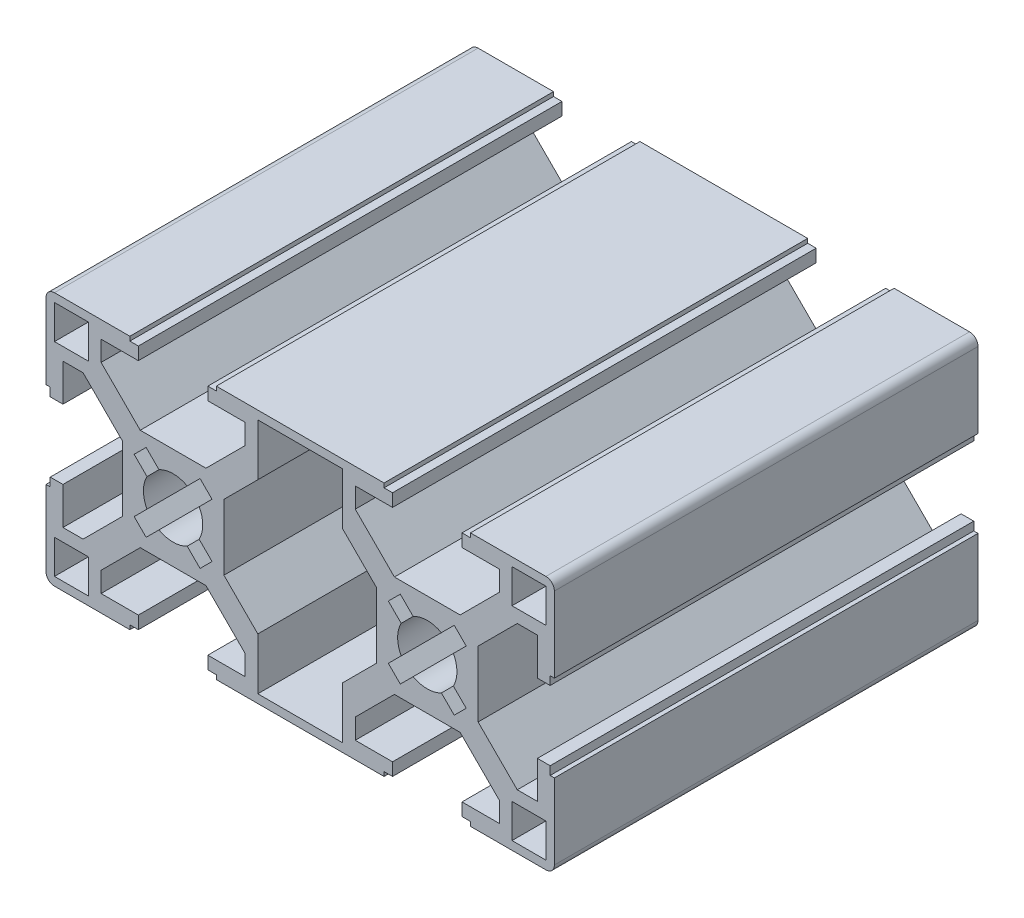
from build123d import *

# Parameters (mm, degrees)
ESBO_O1_W                      = 4
ESBO_O1_H                      = 4
RESSALTO_EXTRUS_O1_DEPTH       = 50
PADR_OCIRCULAR1_COUNT          = 4
PADR_O_LINEAR1_COUNT           = 2
PADR_O_LINEAR1_PITCH           = 30
PADR_O_LINEAR1_COPY_1_SKETCH_W = 4
PADR_O_LINEAR1_COPY_1_SKETCH_H = 4
PADR_O_LINEAR1_COPY_1_DEPTH    = 50
PADR_O_LINEAR1_COPY_2_SKETCH_W = 4
PADR_O_LINEAR1_COPY_2_SKETCH_H = 4
PADR_O_LINEAR1_COPY_2_DEPTH    = 50
PADR_O_LINEAR1_COPY_3_SKETCH_W = 4
PADR_O_LINEAR1_COPY_3_SKETCH_H = 4
PADR_O_LINEAR1_COPY_3_DEPTH    = 50
ESBO_O4_W                      = 10
ESBO_O4_H                      = 28
CORTE_EXTRUS_O1_DEPTH          = 69.92024376
FILETE1_R                      = 1


with BuildPart() as part:
    # Esboço1 → Ressalto-extrusão1 (new body)
    with BuildSketch(Plane.XY):
        with BuildLine():
            ThreePointArc((-1.664601464, 3.078815026), (-0.858529967, 3.393070335), (0, 3.5))
            Line((0, 3.5), (0, 6))
            Line((0, 6), (-3.878679656, 6))
            Line((-3.878679656, 6), (-8.5, 10.621320344))
            Line((-8.5, 10.621320344), (-8.5, 13))
            Line((-8.5, 13), (-4.1, 13))
            Line((-4.1, 13), (-4.1, 14.5))
            Line((-4.1, 14.5), (-5.1, 14.5))
            Line((-5.1, 14.5), (-5.1, 15))
            Line((-5.1, 15), (-15, 15))
            Line((-15, 15), (-15, 5.1))
            Line((-15, 5.1), (-14.5, 5.1))
            Line((-14.5, 5.1), (-14.5, 4.1))
            Line((-14.5, 4.1), (-13, 4.1))
            Line((-13, 4.1), (-13, 8.5))
            Line((-13, 8.5), (-10.621320344, 8.5))
            Line((-10.621320344, 8.5), (-6, 3.878679656))
            Line((-6, 3.878679656), (-6, 0))
            Line((-6, 0), (-3.5, 0))
            ThreePointArc((-3.5, 0), (-3.393070335, 0.858529967), (-3.078815026, 1.664601464))
            Line((-3.078815026, 1.664601464), (-4.596194078, 3.181980515))
            Line((-4.596194078, 3.181980515), (-3.181980515, 4.596194078))
            Line((-3.181980515, 4.596194078), (-1.664601464, 3.078815026))
        make_face()
        with Locations((-12, 12)):
            Rectangle(ESBO_O1_W, ESBO_O1_H, mode=Mode.SUBTRACT)
    ressalto_extrus_o1 = extrude(amount=RESSALTO_EXTRUS_O1_DEPTH)

    # PadrãoCircular1: Ressalto-extrusão1 ×4 about axis
    padr_ocircular1_axis = Axis((0, 0, 0), (0, 0, 1))
    for i in range(1, PADR_OCIRCULAR1_COUNT):
        add(ressalto_extrus_o1.rotate(padr_ocircular1_axis, i * 360 / PADR_OCIRCULAR1_COUNT))

    # Padrão linear1: Ressalto-extrusão1 ×2
    with Locations(*[(i * PADR_O_LINEAR1_PITCH, 0, 0) for i in range(1, PADR_O_LINEAR1_COUNT)]):
        add(ressalto_extrus_o1)

    # Padrão linear1 copy 1 sketch → Padrão linear1 copy 1 (add)
    with BuildSketch(Plane(origin=(30, 0, 0), x_dir=(0, 1, 0), z_dir=(0, 0, 1))):
        with BuildLine():
            ThreePointArc((-1.664601464, 3.078815026), (-0.858529967, 3.393070335), (0, 3.5))
            Line((0, 3.5), (0, 6))
            Line((0, 6), (-3.878679656, 6))
            Line((-3.878679656, 6), (-8.5, 10.621320344))
            Line((-8.5, 10.621320344), (-8.5, 13))
            Line((-8.5, 13), (-4.1, 13))
            Line((-4.1, 13), (-4.1, 14.5))
            Line((-4.1, 14.5), (-5.1, 14.5))
            Line((-5.1, 14.5), (-5.1, 15))
            Line((-5.1, 15), (-15, 15))
            Line((-15, 15), (-15, 5.1))
            Line((-15, 5.1), (-14.5, 5.1))
            Line((-14.5, 5.1), (-14.5, 4.1))
            Line((-14.5, 4.1), (-13, 4.1))
            Line((-13, 4.1), (-13, 8.5))
            Line((-13, 8.5), (-10.621320344, 8.5))
            Line((-10.621320344, 8.5), (-6, 3.878679656))
            Line((-6, 3.878679656), (-6, 0))
            Line((-6, 0), (-3.5, 0))
            ThreePointArc((-3.5, 0), (-3.393070335, 0.858529967), (-3.078815026, 1.664601464))
            Line((-3.078815026, 1.664601464), (-4.596194078, 3.181980515))
            Line((-4.596194078, 3.181980515), (-3.181980515, 4.596194078))
            Line((-3.181980515, 4.596194078), (-1.664601464, 3.078815026))
        make_face()
        with Locations((-12, 12)):
            Rectangle(PADR_O_LINEAR1_COPY_1_SKETCH_W, PADR_O_LINEAR1_COPY_1_SKETCH_H, mode=Mode.SUBTRACT)
    extrude(amount=PADR_O_LINEAR1_COPY_1_DEPTH)

    # Padrão linear1 copy 2 sketch → Padrão linear1 copy 2 (add)
    with BuildSketch(Plane(origin=(30, 0, 0), x_dir=(-1, 0, 0), z_dir=(0, 0, 1))):
        with BuildLine():
            ThreePointArc((-1.664601464, 3.078815026), (-0.858529967, 3.393070335), (0, 3.5))
            Line((0, 3.5), (0, 6))
            Line((0, 6), (-3.878679656, 6))
            Line((-3.878679656, 6), (-8.5, 10.621320344))
            Line((-8.5, 10.621320344), (-8.5, 13))
            Line((-8.5, 13), (-4.1, 13))
            Line((-4.1, 13), (-4.1, 14.5))
            Line((-4.1, 14.5), (-5.1, 14.5))
            Line((-5.1, 14.5), (-5.1, 15))
            Line((-5.1, 15), (-15, 15))
            Line((-15, 15), (-15, 5.1))
            Line((-15, 5.1), (-14.5, 5.1))
            Line((-14.5, 5.1), (-14.5, 4.1))
            Line((-14.5, 4.1), (-13, 4.1))
            Line((-13, 4.1), (-13, 8.5))
            Line((-13, 8.5), (-10.621320344, 8.5))
            Line((-10.621320344, 8.5), (-6, 3.878679656))
            Line((-6, 3.878679656), (-6, 0))
            Line((-6, 0), (-3.5, 0))
            ThreePointArc((-3.5, 0), (-3.393070335, 0.858529967), (-3.078815026, 1.664601464))
            Line((-3.078815026, 1.664601464), (-4.596194078, 3.181980515))
            Line((-4.596194078, 3.181980515), (-3.181980515, 4.596194078))
            Line((-3.181980515, 4.596194078), (-1.664601464, 3.078815026))
        make_face()
        with Locations((-12, 12)):
            Rectangle(PADR_O_LINEAR1_COPY_2_SKETCH_W, PADR_O_LINEAR1_COPY_2_SKETCH_H, mode=Mode.SUBTRACT)
    extrude(amount=PADR_O_LINEAR1_COPY_2_DEPTH)

    # Padrão linear1 copy 3 sketch → Padrão linear1 copy 3 (add)
    with BuildSketch(Plane(origin=(30, 0, 0), x_dir=(0, -1, 0), z_dir=(0, 0, 1))):
        with BuildLine():
            ThreePointArc((-1.664601464, 3.078815026), (-0.858529967, 3.393070335), (0, 3.5))
            Line((0, 3.5), (0, 6))
            Line((0, 6), (-3.878679656, 6))
            Line((-3.878679656, 6), (-8.5, 10.621320344))
            Line((-8.5, 10.621320344), (-8.5, 13))
            Line((-8.5, 13), (-4.1, 13))
            Line((-4.1, 13), (-4.1, 14.5))
            Line((-4.1, 14.5), (-5.1, 14.5))
            Line((-5.1, 14.5), (-5.1, 15))
            Line((-5.1, 15), (-15, 15))
            Line((-15, 15), (-15, 5.1))
            Line((-15, 5.1), (-14.5, 5.1))
            Line((-14.5, 5.1), (-14.5, 4.1))
            Line((-14.5, 4.1), (-13, 4.1))
            Line((-13, 4.1), (-13, 8.5))
            Line((-13, 8.5), (-10.621320344, 8.5))
            Line((-10.621320344, 8.5), (-6, 3.878679656))
            Line((-6, 3.878679656), (-6, 0))
            Line((-6, 0), (-3.5, 0))
            ThreePointArc((-3.5, 0), (-3.393070335, 0.858529967), (-3.078815026, 1.664601464))
            Line((-3.078815026, 1.664601464), (-4.596194078, 3.181980515))
            Line((-4.596194078, 3.181980515), (-3.181980515, 4.596194078))
            Line((-3.181980515, 4.596194078), (-1.664601464, 3.078815026))
        make_face()
        with Locations((-12, 12)):
            Rectangle(PADR_O_LINEAR1_COPY_3_SKETCH_W, PADR_O_LINEAR1_COPY_3_SKETCH_H, mode=Mode.SUBTRACT)
    extrude(amount=PADR_O_LINEAR1_COPY_3_DEPTH)

    # Esboço4 → Corte-extrusão1 (cut, through all)
    with BuildSketch(Plane(origin=(0, 0, 0), x_dir=(-1, 0, 0), z_dir=(0, 0, -1))):
        with Locations((-15, 0)):
            Rectangle(ESBO_O4_W, ESBO_O4_H)
    extrude(amount=-CORTE_EXTRUS_O1_DEPTH, mode=Mode.SUBTRACT)

    # Filete1
    filete1_edges = [part.edges().sort_by_distance(p)[0] for p in [
        (45, -15, 25),
        (45, 15, 25),
        (-15, 15, 25),
        (-15, -15, 25),
    ]]
    fillet(filete1_edges, radius=FILETE1_R)


solid = part.part
